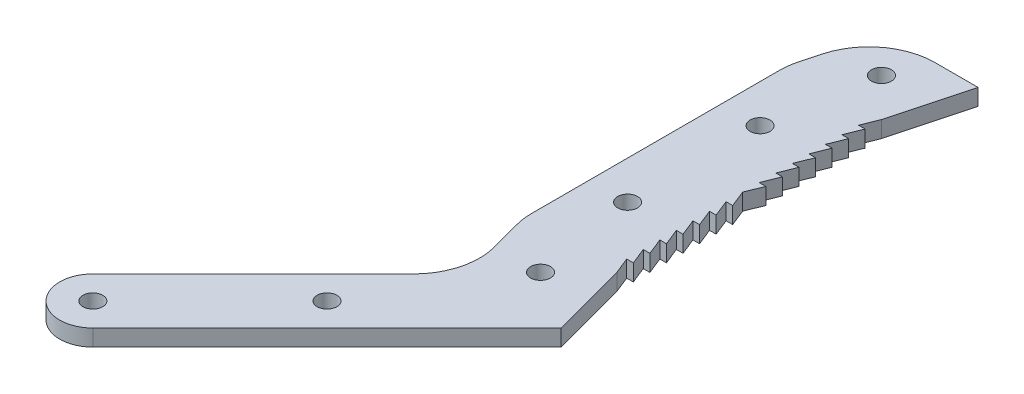
from build123d import *

# Parameters (mm, degrees)
SKETCH1_R           = 1.5
BOSS_EXTRUDE1_DEPTH = 1.25
FILLET2_R           = 10


with BuildPart() as part:
    # Sketch1 → Boss-Extrude1 (new, symmetric)
    with BuildSketch(Plane(origin=(0, 0, 0), x_dir=(1, 0, 0), z_dir=(0, 1, 0))):
        with BuildLine():
            Line((-39.748737342, -46.819805153), (-4.393398282, -11.464466094))
            Line((-4.393398282, -11.464466094), (-7.465292714, 0))
            Line((-7.465292714, 0), (-8.465292714, 2.5))
            Line((-8.465292714, 2.5), (-7.465292714, 2.5))
            Line((-7.465292714, 2.5), (-8.465292714, 5))
            Line((-8.465292714, 5), (-7.465292714, 5))
            Line((-7.465292714, 5), (-8.465292714, 7.5))
            Line((-8.465292714, 7.5), (-7.465292714, 7.5))
            Line((-7.465292714, 7.5), (-8.465292714, 10))
            Line((-8.465292714, 10), (-7.465292714, 10))
            Line((-7.465292714, 10), (-8.465292714, 12.5))
            Line((-8.465292714, 12.5), (-7.465292714, 12.5))
            Line((-7.465292714, 12.5), (-8.465292714, 15))
            Line((-8.465292714, 15), (-7.465292714, 15))
            Line((-7.465292714, 15), (-8.465292714, 17.5))
            Line((-8.465292714, 17.5), (-7.465292714, 17.5))
            Line((-7.465292714, 17.5), (-8.465292714, 20))
            Line((-8.465292714, 20), (-7.465292714, 22.5))
            Line((-7.465292714, 22.5), (-8.465292714, 22.5))
            Line((-8.465292714, 22.5), (-7.465292714, 25))
            Line((-7.465292714, 25), (-8.465292714, 25))
            Line((-8.465292714, 25), (-7.465292714, 27.5))
            Line((-7.465292714, 27.5), (-8.465292714, 27.5))
            Line((-8.465292714, 27.5), (-7.465292714, 30))
            Line((-7.465292714, 30), (-8.465292714, 30))
            Line((-8.465292714, 30), (-7.465292714, 32.5))
            Line((-7.465292714, 32.5), (-8.465292714, 32.5))
            Line((-8.465292714, 32.5), (-7.465292714, 35))
            Line((-7.465292714, 35), (-8.465292714, 35))
            Line((-8.465292714, 35), (-7.465292714, 37.5))
            Line((-7.465292714, 37.5), (-8.465292714, 37.5))
            Line((-8.465292714, 37.5), (-7.465292714, 40))
            Line((-7.465292714, 40), (-4.393398282, 51.464466094))
            Line((-4.393398282, 51.464466094), (-18.535533906, 51.464466094))
            Line((-18.535533906, 51.464466094), (-21.607428337, 40))
            Line((-21.607428337, 40), (-21.607428337, 0))
            Line((-21.607428337, 0), (-18.535533906, -11.464466094))
            Line((-18.535533906, -11.464466094), (-46.819805153, -39.748737342))
            ThreePointArc((-46.819805153, -39.748737342), (-46.819805153, -46.819805153), (-39.748737342, -46.819805153))
        make_face()
        with Locations((-43.284271247, -43.284271247)):
            Circle(SKETCH1_R, mode=Mode.SUBTRACT)
        with Locations((-25.606601718, -25.606601718)):
            Circle(SKETCH1_R, mode=Mode.SUBTRACT)
        with Locations((-13.241481122, 45.732233047)):
            Circle(SKETCH1_R, mode=Mode.SUBTRACT)
        with Locations((-13.241481122, -5.732233047)):
            Circle(SKETCH1_R, mode=Mode.SUBTRACT)
        with Locations((-15.832428337, 10)):
            Circle(SKETCH1_R, mode=Mode.SUBTRACT)
        with Locations((-15.832428337, 30)):
            Circle(SKETCH1_R, mode=Mode.SUBTRACT)
    extrude(amount=BOSS_EXTRUDE1_DEPTH, both=True)

    # Fillet2
    fillet2_edges = [part.edges().sort_by_distance(p)[0] for p in [
        (-18.535533906, 0, 11.464466094),
        (-21.607428337, 0, 0),
        (-21.607428337, 0, -40),
        (-18.535533906, 0, -51.464466094),
    ]]
    fillet(fillet2_edges, radius=FILLET2_R)


solid = part.part
